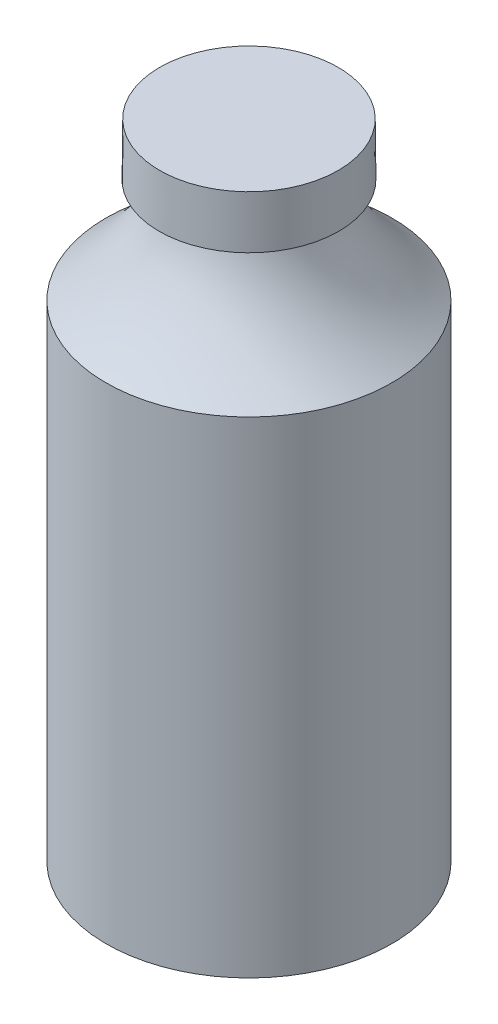
from build123d import *


with BuildPart() as part:
    # Sketch1 → Revolve1 (revolve)
    with BuildSketch(Plane.XY):
        with BuildLine():
            Line((-6.164098613, 117.205932203), (-6.164098613, -111.394067797))
            Line((-6.164098613, -111.394067797), (-56.964098613, -111.394067797))
            Line((-56.964098613, -111.394067797), (-56.964098613, 61.325932203))
            add(Edge.make_bspline(
                [(-56.964098613, 61.325932203), (-26.35612057, 85.728794243), (-31.564098613, 117.205932203)],
                knots=[0, 0, 0, 1, 1, 1], degree=2))
            Line((-31.564098613, 117.205932203), (-6.164098613, 117.205932203))
        make_face()
    revolve(axis=Axis((-6.164098613, 117.205932203, 0), (0, -1, 0)))

    # Sketch2 → Revolve2 (revolve)
    with BuildSketch(Plane.XY, mode=Mode.PRIVATE) as revolve2_sk:
        with BuildLine():
            Line((-38.092265218, 98.544461924), (-31.742265218, 98.544461924))
            add(Edge.make_bspline(
                [(-31.564098599, 117.205932119), (-29.965138201, 107.541778952), (-31.742265218, 98.544461924)],
                knots=[0, 0, 0, 0.307021343, 0.307021343, 0.307021343], degree=2))
            Line((-31.564098599, 117.205932119), (-37.914098599, 117.205932119))
            Line((-37.914098599, 117.205932119), (-38.092265218, 98.544461924))
        make_face()
    revolve(revolve2_sk.sketch.rotate(Axis((-6.164098613, -111.394067797, 0), (0, 1, 0)), 180), axis=Axis((-6.164098613, -111.394067797, 0), (0, 1, 0)))


solid = part.part
